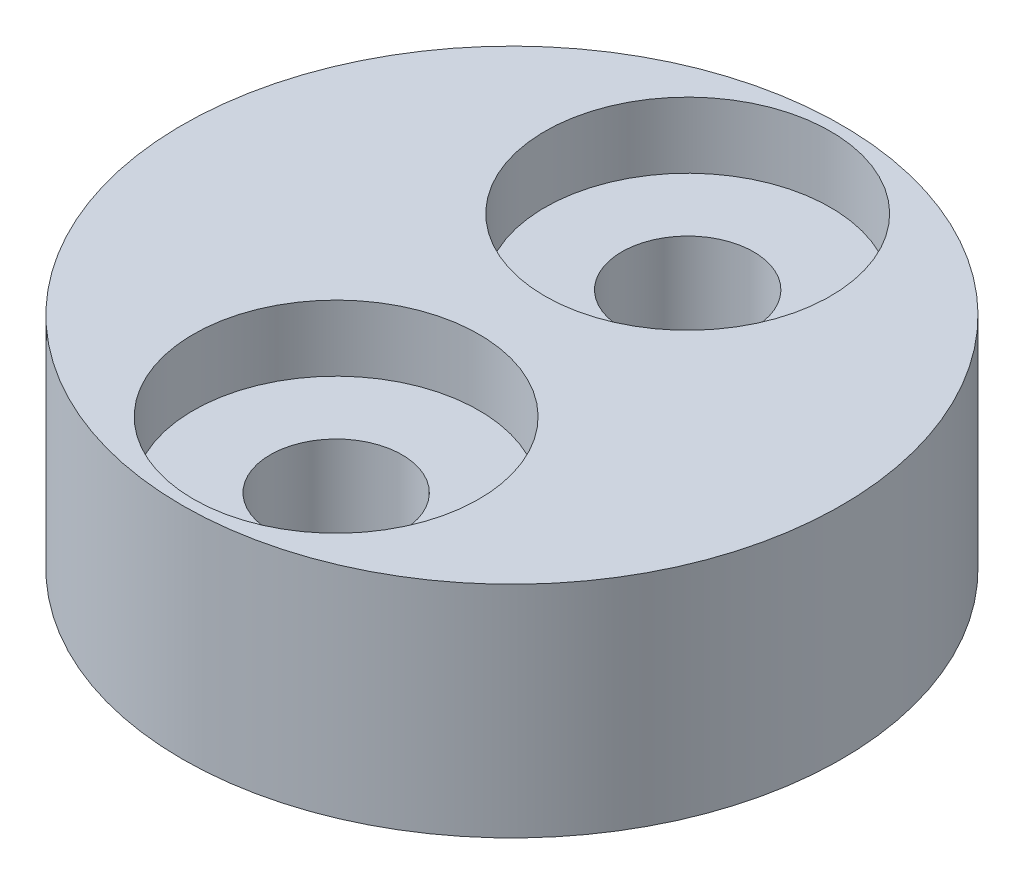
from build123d import *

# Parameters (mm, degrees)
SKETCH1_R           = 7.5
SKETCH1_R_2         = 1.5
BOSS_EXTRUDE1_DEPTH = 5
SKETCH2_R           = 3.25
CUT_EXTRUDE1_DEPTH  = 1.5


with BuildPart() as part:
    # Sketch1 → Boss-Extrude1 (new body)
    with BuildSketch(Plane(origin=(0, 0, 0), x_dir=(1, 0, 0), z_dir=(0, 1, 0))):
        with Locations(Location((0, 0, 0), (0, 0, 270))):
            Circle(SKETCH1_R)
        with Locations(Location((0, 4, 0), (0, 0, 270))):
            Circle(SKETCH1_R_2, mode=Mode.SUBTRACT)
        with Locations(Location((0, -4, 0), (0, 0, 270))):
            Circle(SKETCH1_R_2, mode=Mode.SUBTRACT)
    extrude(amount=BOSS_EXTRUDE1_DEPTH)

    # Sketch2 → Cut-Extrude1 (cut)
    with BuildSketch(Plane(origin=(0, 5, 0), x_dir=(1, 0, 0), z_dir=(0, 1, 0))):
        with Locations(Location((0, 4, 0), (0, 0, 270))):
            Circle(SKETCH2_R)
        with Locations(Location((0, -4, 0), (0, 0, 270))):
            Circle(SKETCH2_R)
    extrude(amount=-CUT_EXTRUDE1_DEPTH, mode=Mode.SUBTRACT)


solid = part.part
